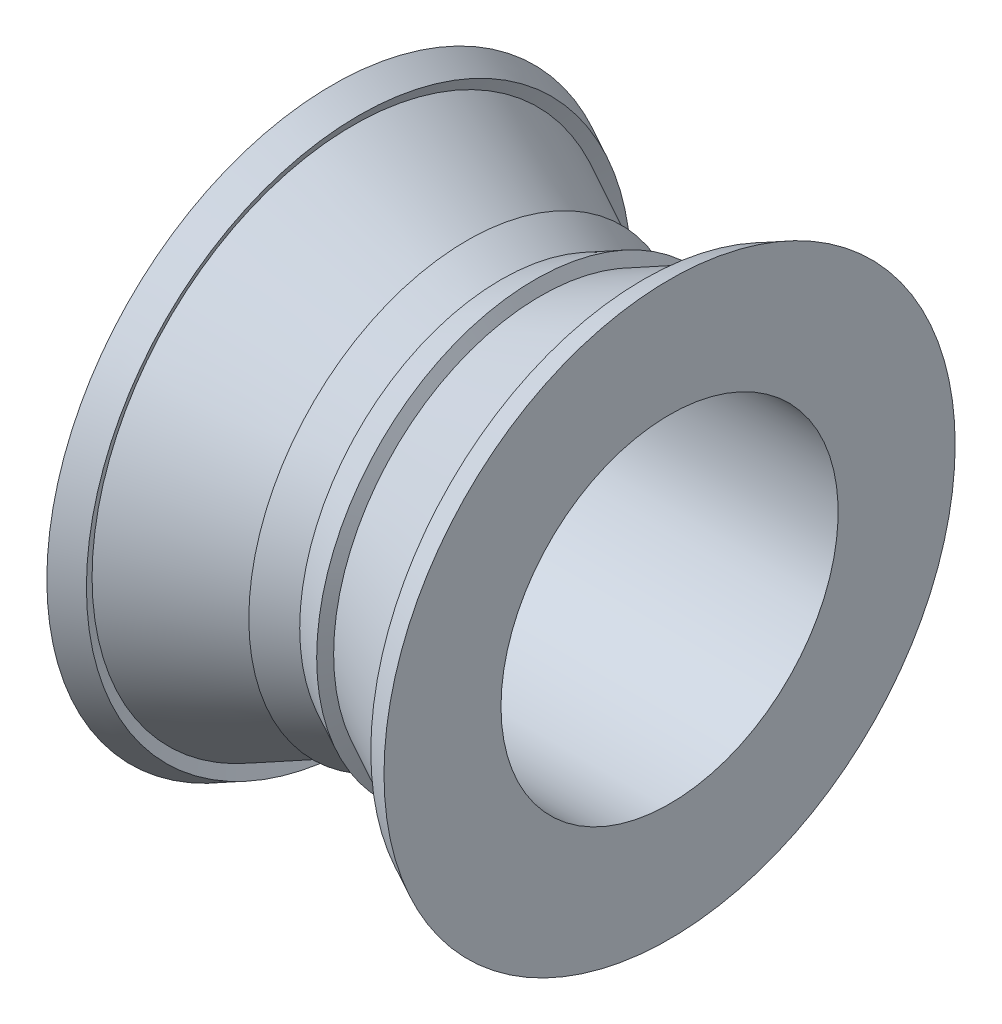
from build123d import *


with BuildPart() as part:
    # Sketch2 → Revolve1 (revolve)
    with BuildSketch(Plane.XY, mode=Mode.PRIVATE) as revolve1_sk:
        Polygon((0, 40), (0, 26.118033989), (3.130495168, 27.683281573), (2.459674775, 29.024922359), (15.304257247, 35.447213595), (15.975077641, 34.105572809), (20, 36.118033989), (24.024922359, 34.105572809), (24.695742753, 35.447213595), (37.540325225, 29.024922359), (36.869504832, 27.683281573), (40, 26.118033989), (40, 40), align=None)
    revolve(revolve1_sk.sketch.rotate(Axis((-8.892831283, 60, 0), (1, 0, 0)), 270), axis=Axis((-8.892831283, 60, 0), (1, 0, 0)))


solid = part.part
